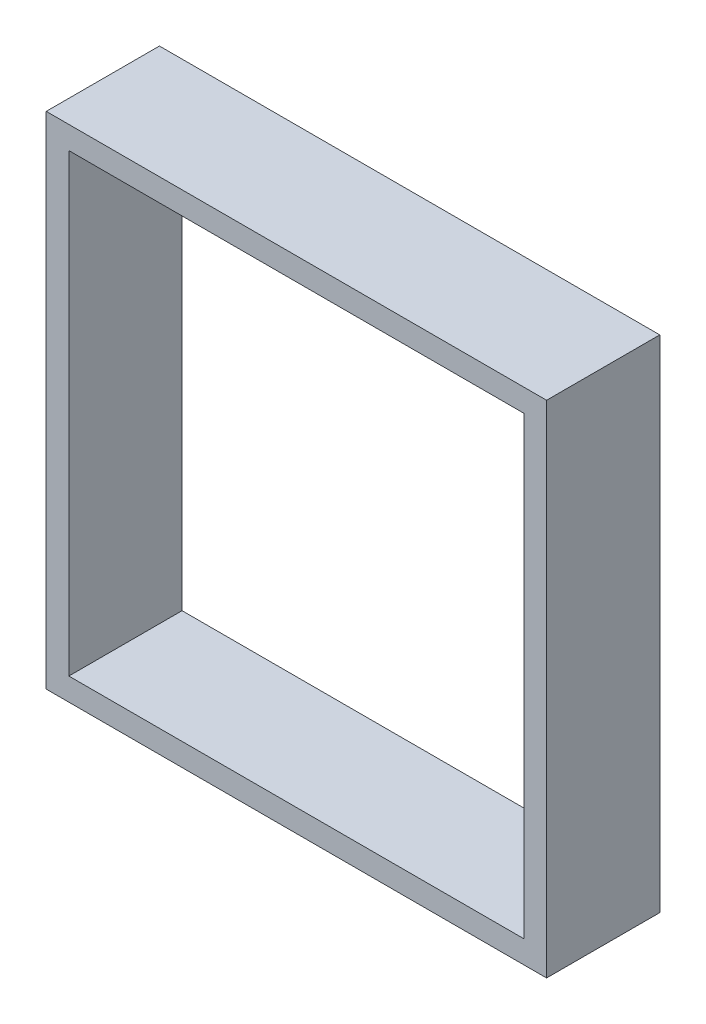
from build123d import *

# Parameters (mm, degrees)
SKETCH_1_W      = 44.2
SKETCH_1_H      = 44.2
SKETCH_1_W_2    = 40.2
SKETCH_1_H_2    = 40.2
EXTRUDE_1_DEPTH = 10


with BuildPart() as part:
    # 草图1 → 凸台-拉伸1 (new body)
    with BuildSketch(Plane.XY):
        with Locations((-25.172727273, -8.354545455)):
            Rectangle(SKETCH_1_W, SKETCH_1_H)
        with Locations((-25.172727273, -8.354545455)):
            Rectangle(SKETCH_1_W_2, SKETCH_1_H_2, mode=Mode.SUBTRACT)
    extrude(amount=EXTRUDE_1_DEPTH)


solid = part.part
